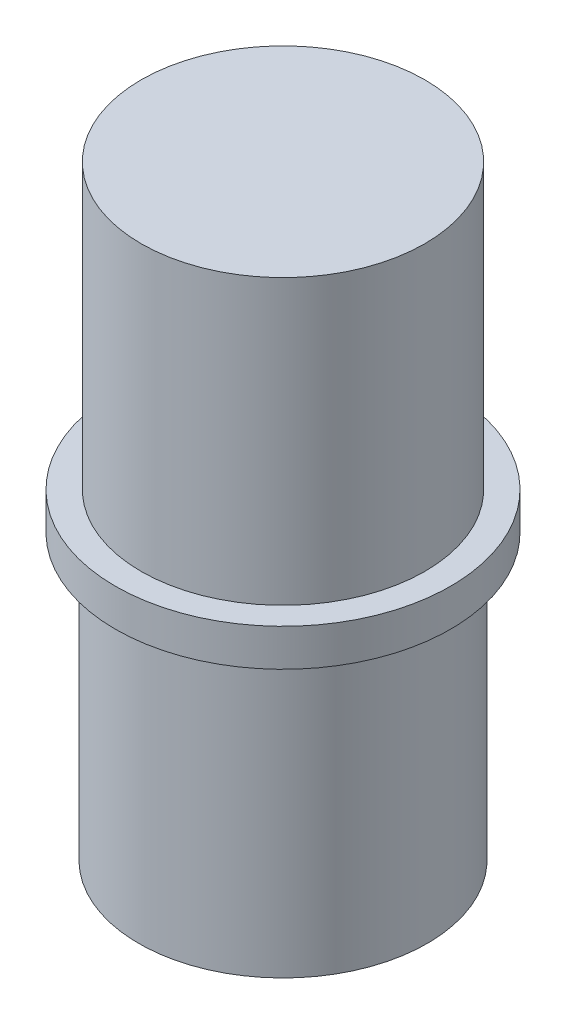
from build123d import *

# Parameters (mm, degrees)
SKETCH1_R           = 3.8735
BOSS_EXTRUDE1_DEPTH = 7.62
SKETCH2_R           = 4.5
BOSS_EXTRUDE2_DEPTH = 1
SKETCH3_R           = 3.81
BOSS_EXTRUDE3_DEPTH = 7.62


with BuildPart() as part:
    # Sketch1 → Boss-Extrude1 (new body)
    with BuildSketch(Plane(origin=(0, 0, 0), x_dir=(1, 0, 0), z_dir=(0, 1, 0))):
        with Locations(Location((0, 0, 0), (0, 0, 90))):
            Circle(SKETCH1_R)
    extrude(amount=BOSS_EXTRUDE1_DEPTH)

    # Sketch2 → Boss-Extrude2 (add)
    with BuildSketch(Plane(origin=(0, 7.62, 0), x_dir=(1, 0, 0), z_dir=(0, 1, 0))):
        with Locations(Location((0, 0, 0), (0, 0, 270))):
            Circle(SKETCH2_R)
    extrude(amount=BOSS_EXTRUDE2_DEPTH)

    # Sketch3 → Boss-Extrude3 (add)
    with BuildSketch(Plane(origin=(0, 8.62, 0), x_dir=(1, 0, 0), z_dir=(0, 1, 0))):
        with Locations(Location((0, 0, 0), (0, 0, 90))):
            Circle(SKETCH3_R)
    extrude(amount=BOSS_EXTRUDE3_DEPTH)


solid = part.part
